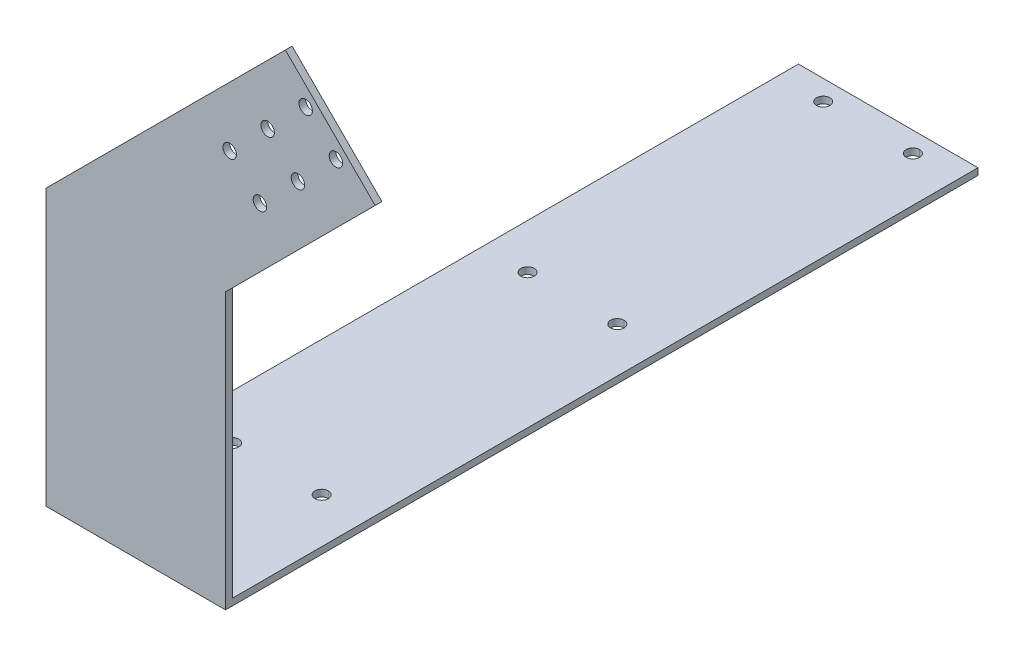
from build123d import *

# Parameters (mm, degrees)
SKETCH1_R           = 161.29
BOSS_EXTRUDE1_DEPTH = 161.29
SKETCH3_W           = 4310.634
SKETCH3_H           = 18064.48
SKETCH3_R           = 161.29
BOSS_EXTRUDE3_DEPTH = 161.29
SCALE2_SCALE        = 0.039370079


with BuildPart() as part:
    # Sketch1 → Boss-Extrude1 (new body)
    with BuildSketch(Plane.XY):
        Polygon((-2155.317, 3225.8), (3592.046917484, 8973.163917484), (5747.419448428, 6817.902448428), (2155.317, 3225.8), (2155.317, -3225.8), (-2155.317, -3225.8), align=None)
        with Locations((4804.833357851, 7304.254711836)):
            Circle(SKETCH1_R, mode=Mode.SUBTRACT)
        with Locations((3892.43933595, 6391.860689935)):
            Circle(SKETCH1_R, mode=Mode.SUBTRACT)
        with Locations((2980.04531405, 5479.466668034)):
            Circle(SKETCH1_R, mode=Mode.SUBTRACT)
        with Locations(Location((2253.753739605, 6205.720818177, 0), (0, 0, 180))):
            Circle(SKETCH1_R, mode=Mode.SUBTRACT)
        with Locations(Location((3166.100745307, 7118.161853854, 0), (0, 0, 180))):
            Circle(SKETCH1_R, mode=Mode.SUBTRACT)
        with Locations(Location((4078.447751009, 8030.602889531, 0), (0, 0, 180))):
            Circle(SKETCH1_R, mode=Mode.SUBTRACT)
    extrude(amount=-BOSS_EXTRUDE1_DEPTH)

    # Sketch3 → Boss-Extrude3 (add)
    with BuildSketch(Plane(origin=(0, -3225.8, 0), x_dir=(-1, 0, 0), z_dir=(0, -1, 0))):
        with Locations((0, 9032.24)):
            Rectangle(SKETCH3_W, SKETCH3_H)
        with BuildLine():
            ThreePointArc((-1076.325000002, 3548.374999923), (-961.455647452, 3501.587385122), (-913.765000004, 3387.09))
            ThreePointArc((-913.765000004, 3387.09), (-961.455647452, 3272.592614878), (-1076.325000002, 3225.805000077))
            ThreePointArc((-1076.325000002, 3225.805000077), (-1238.885, 3387.09), (-1076.325000002, 3548.374999923))
        make_face(mode=Mode.SUBTRACT)
        with Locations(Location((1075.054999996, 3387.089999999, 0), (0, 0, 180))):
            Circle(SKETCH3_R, mode=Mode.SUBTRACT)
        with BuildLine():
            ThreePointArc((-1076.325000001, 10322.565000077), (-1238.885, 10483.85), (-1076.325, 10645.134999923))
            ThreePointArc((-1076.325, 10645.134999923), (-961.455647452, 10598.347385122), (-913.765000004, 10483.85))
            ThreePointArc((-913.765000004, 10483.85), (-961.455647452, 10369.352614878), (-1076.325000001, 10322.565000077))
        make_face(mode=Mode.SUBTRACT)
        with BuildLine():
            ThreePointArc((-1076.325000002, 17419.325000077), (-1238.885, 17580.61), (-1076.325000002, 17741.894999923))
            ThreePointArc((-1076.325000002, 17741.894999923), (-961.455647452, 17695.107385122), (-913.765000004, 17580.61))
            ThreePointArc((-913.765000004, 17580.61), (-961.455647452, 17466.112614878), (-1076.325000002, 17419.325000077))
        make_face(mode=Mode.SUBTRACT)
        with Locations(Location((1077.594999996, 10483.849999999, 0), (0, 0, 180))):
            Circle(SKETCH3_R, mode=Mode.SUBTRACT)
        with Locations(Location((1077.595, 17580.609999999, 0), (0, 0, 180))):
            Circle(SKETCH3_R, mode=Mode.SUBTRACT)
    extrude(amount=BOSS_EXTRUDE3_DEPTH)


with BuildPart() as part_1:
    # Scale2: scaled about (342.584657251, -1172.717670217, -5623.777851714)
    add(part.part.scale(SCALE2_SCALE).moved(Location((329.09707232, -1126.547683201, -5402.369274875))))


solid = part_1.part
